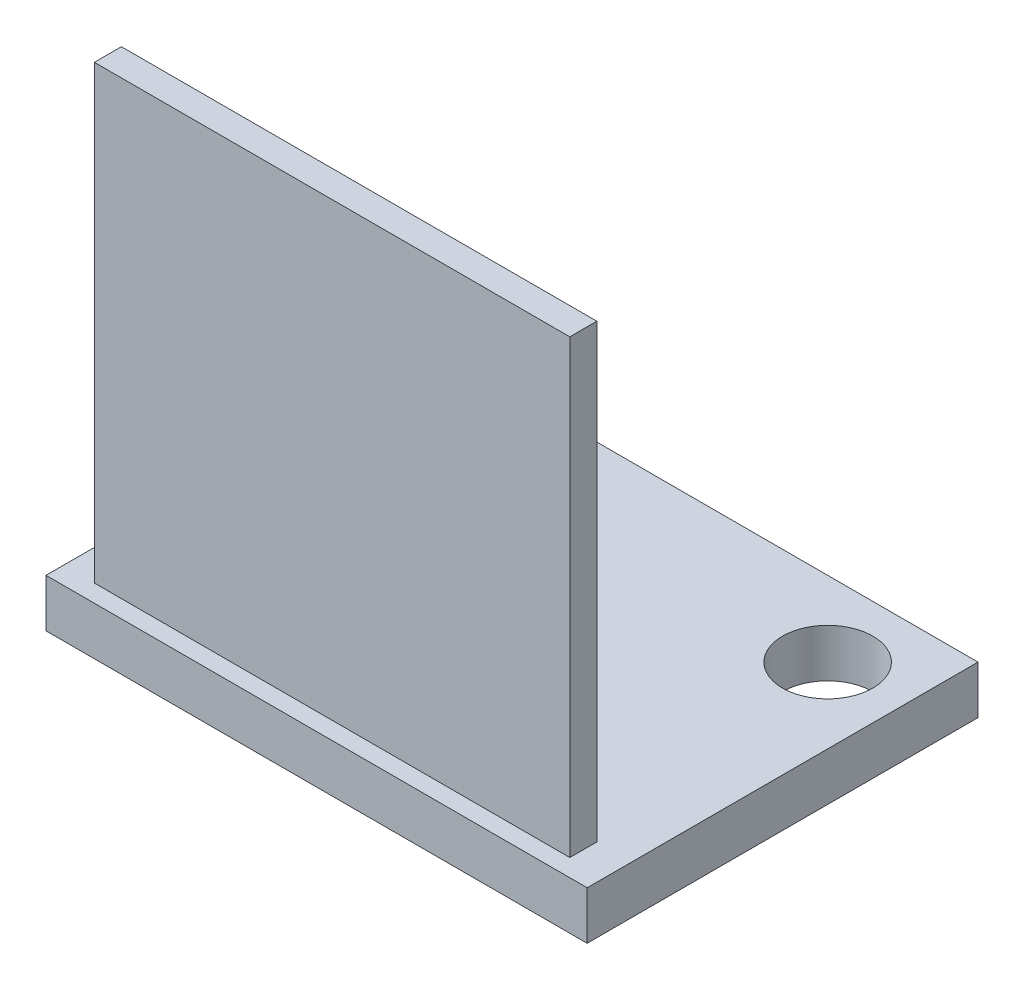
from build123d import *

# Parameters (mm, degrees)
SKETCH_1_W      = 18
SKETCH_1_H      = 13
SKETCH_1_R      = 1.5
EXTRUDE_1_DEPTH = 1.6
SKETCH_2_W      = 15
SKETCH_2_H      = 1.5
EXTRUDE_2_DEPTH = 1
SKETCH_3_W      = 15.814161569
SKETCH_3_H      = 0.898910236
EXTRUDE_3_DEPTH = 15


with BuildPart() as part:
    # 草图1 → 凸台-拉伸1 (new body)
    with BuildSketch(Plane(origin=(0, 0, 0), x_dir=(1, 0, 0), z_dir=(0, 1, 0))):
        with Locations((9, -6.5)):
            Rectangle(SKETCH_1_W, SKETCH_1_H)
        with Locations(Location((2.5, -2.5, 0), (0, 0, 270))):
            Circle(SKETCH_1_R, mode=Mode.SUBTRACT)
        with Locations(Location((15.5, -2.5, 0), (0, 0, 270))):
            Circle(SKETCH_1_R, mode=Mode.SUBTRACT)
    extrude(amount=EXTRUDE_1_DEPTH)

    # 草图2 → 凸台-拉伸2 (add)
    with BuildSketch(Plane.XZ):
        with Locations((9, 11.25)):
            Rectangle(SKETCH_2_W, SKETCH_2_H)
    extrude(amount=EXTRUDE_2_DEPTH)

    # 草图3 → 凸台-拉伸3 (add)
    with BuildSketch(Plane(origin=(0, 1.6, 0), x_dir=(1, 0, 0), z_dir=(0, 1, 0))):
        with Locations((8.933414057, -11.968370606)):
            Rectangle(SKETCH_3_W, SKETCH_3_H)
    extrude(amount=EXTRUDE_3_DEPTH)


solid = part.part
